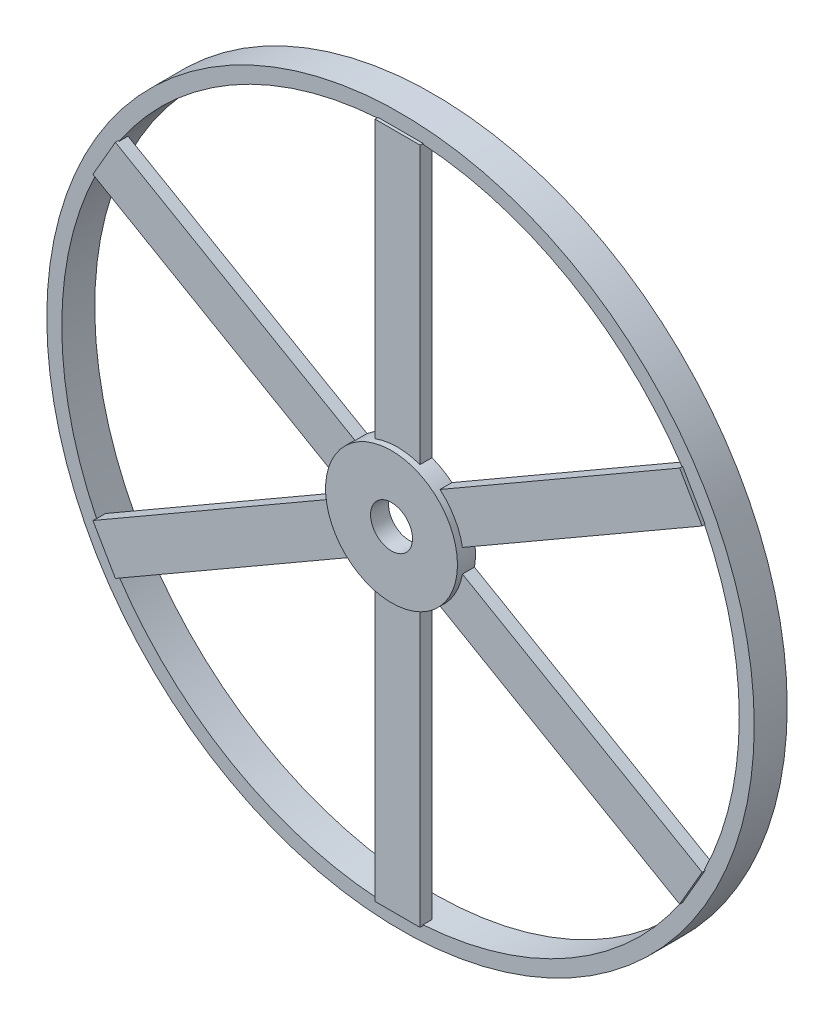
from build123d import *

# Parameters (mm, degrees)
SKETCH_1_R               = 118
SKETCH_1_R_2             = 113
EXTRUDE_1_DEPTH          = 11
EXTRUDE_START            = -3
SKETCH_2_W               = 15
SKETCH_2_H               = 98.117087724
EXTRUDE_2_DEPTH          = 4
PATTERN_CIRCULAR_1_COUNT = 6
EXTRUDE_3_DEPTH          = 3
EXTRUDE_3_DEPTH_BACK     = 3
SKETCH_3_R               = 22
SKETCH_3_R_2             = 7


with BuildPart() as part:
    # 草图1 → 拉伸-薄壁1 (new body)
    with BuildSketch(Plane.XY):
        Circle(SKETCH_1_R)
        Circle(SKETCH_1_R_2, mode=Mode.SUBTRACT)
    extrude(amount=EXTRUDE_1_DEPTH)

    # 草图2 → 拉伸-薄壁2 (add)
    with BuildSketch(Plane.XY.offset(11).offset(EXTRUDE_START)):
        with Locations((0, 63.941456138)):
            Rectangle(SKETCH_2_W, SKETCH_2_H)
    extrude_2 = extrude(amount=EXTRUDE_2_DEPTH)

    # 阵列(圆周)1: 拉伸-薄壁2 ×6 about axis
    pattern_circular_1_axis = Axis((0, 0, 0), (0, 0, 1))
    for i in range(1, PATTERN_CIRCULAR_1_COUNT):
        add(extrude_2.rotate(pattern_circular_1_axis, i * 360 / PATTERN_CIRCULAR_1_COUNT))

    # 草图3 → 拉伸-薄壁3 (add, two sides: drawn at the far end of the back side and taken through both)
    with BuildSketch(Plane.XY.offset(11).offset(-EXTRUDE_3_DEPTH_BACK)):
        Circle(SKETCH_3_R)
        Circle(SKETCH_3_R_2, mode=Mode.SUBTRACT)
    extrude(amount=EXTRUDE_3_DEPTH + EXTRUDE_3_DEPTH_BACK)


solid = part.part
